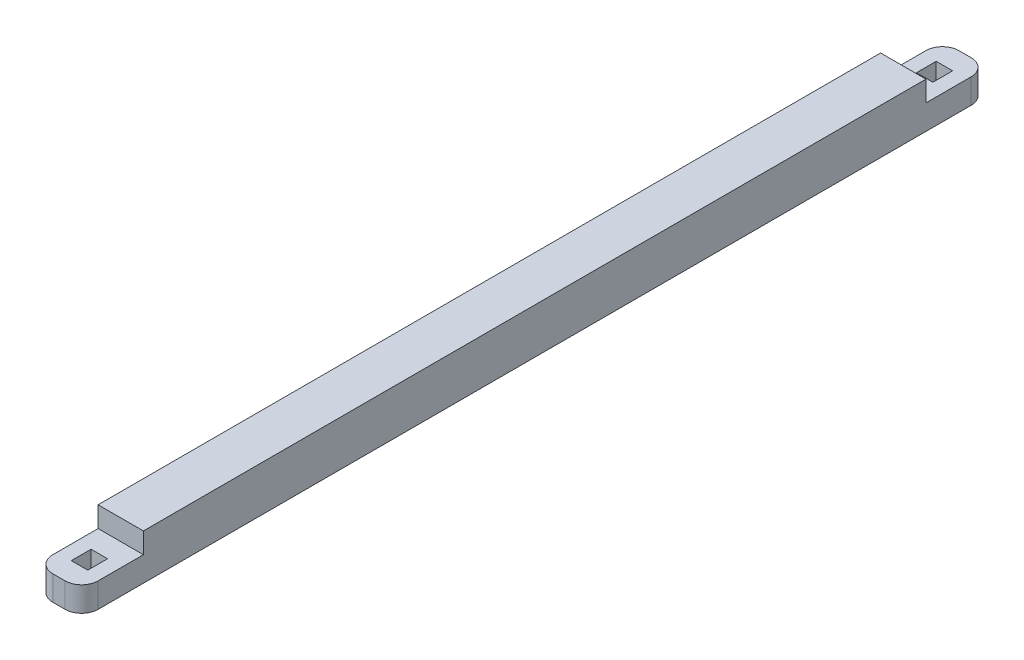
from build123d import *

# Parameters (mm, degrees)
SKETCH1_W           = 34.925
SKETCH1_H           = 34.925
BOSS_EXTRUDE1_DEPTH = 698.5
SKETCH2_W           = 47.625
SKETCH2_H           = 15.875
CUT_EXTRUDE1_DEPTH  = 127
SKETCH3_W           = 12.7
SKETCH3_H           = 15.24
CUT_EXTRUDE2_DEPTH  = 728.836573147
FILLET1_R           = 12.7


with BuildPart() as part:
    # Sketch1 → Boss-Extrude1 (new body)
    with BuildSketch(Plane.XY):
        with Locations((186.206164037, 61.261572703)):
            Rectangle(SKETCH1_W, SKETCH1_H)
    extrude(amount=BOSS_EXTRUDE1_DEPTH)

    # Sketch2 → Cut-Extrude1 (cut)
    with BuildSketch(Plane(origin=(203.668664037, 0, 0), x_dir=(0, 0, -1), z_dir=(1, 0, 0))):
        with Locations((-23.8125, 70.786572703)):
            Rectangle(SKETCH2_W, SKETCH2_H)
        with Locations((-674.6875, 70.786572703)):
            Rectangle(SKETCH2_W, SKETCH2_H)
    extrude(amount=-CUT_EXTRUDE1_DEPTH, mode=Mode.SUBTRACT)

    # Sketch3 → Cut-Extrude2 (cut, through all)
    with BuildSketch(Plane(origin=(0, 62.849072703, 0), x_dir=(1, 0, 0), z_dir=(0, 1, 0))):
        with Locations((186.206164037, -675.005)):
            Rectangle(SKETCH3_W, SKETCH3_H)
        with Locations((186.206164037, -23.495)):
            Rectangle(SKETCH3_W, SKETCH3_H)
    extrude(amount=-CUT_EXTRUDE2_DEPTH, mode=Mode.SUBTRACT)

    # Fillet1
    fillet1_edges = [part.edges().sort_by_distance(p)[0] for p in [
        (203.668664037, 53.324072703, 698.5),
        (168.743664037, 53.324072703, 698.5),
        (168.743664037, 53.324072703, 0),
        (203.668664037, 53.324072703, 0),
    ]]
    fillet(fillet1_edges, radius=FILLET1_R)


solid = part.part
